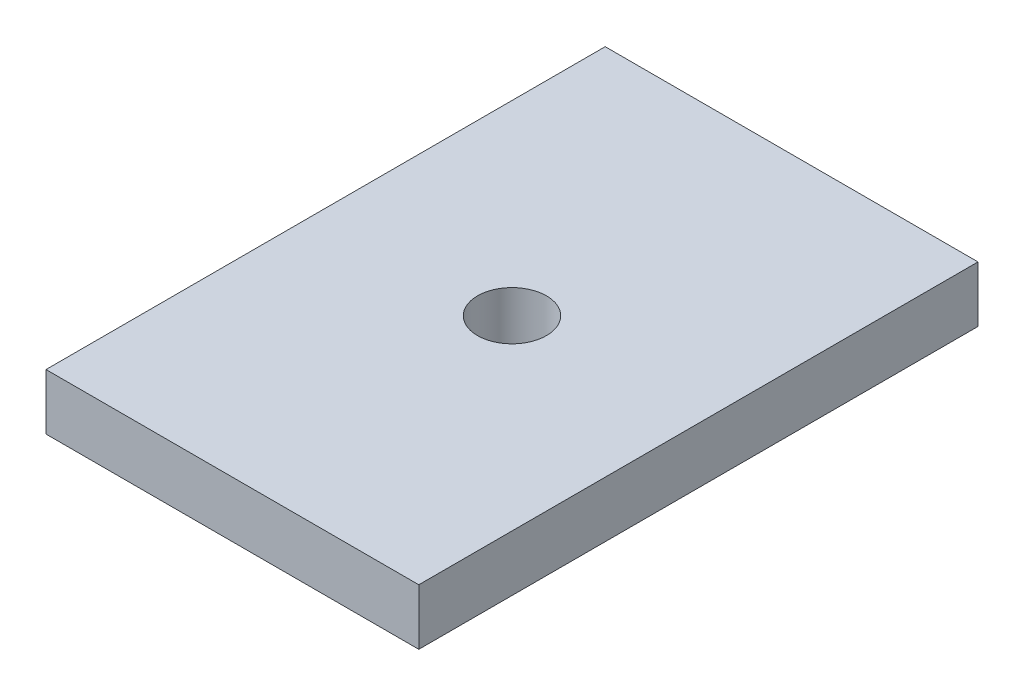
from build123d import *

# Parameters (mm, degrees)
SKETCH_1_W          = 20
SKETCH_1_H          = 30
EXTRUDE_1_DEPTH     = 3
SKETCH_2_R          = 1.85
CUT_EXTRUDE_1_DEPTH = 3


with BuildPart() as part:
    # 草图1 → 凸台-拉伸1 (new body)
    with BuildSketch(Plane(origin=(0, 0, 0), x_dir=(1, 0, 0), z_dir=(0, 1, 0))):
        Rectangle(SKETCH_1_W, SKETCH_1_H)
    extrude(amount=EXTRUDE_1_DEPTH)

    # 草图2 → 切除-拉伸1 (cut)
    with BuildSketch(Plane(origin=(0, 3, 0), x_dir=(1, 0, 0), z_dir=(0, 1, 0))):
        with Locations(Location((0, 0, 0), (0, 0, 270))):
            Circle(SKETCH_2_R)
    extrude(amount=-CUT_EXTRUDE_1_DEPTH, mode=Mode.SUBTRACT)


solid = part.part
